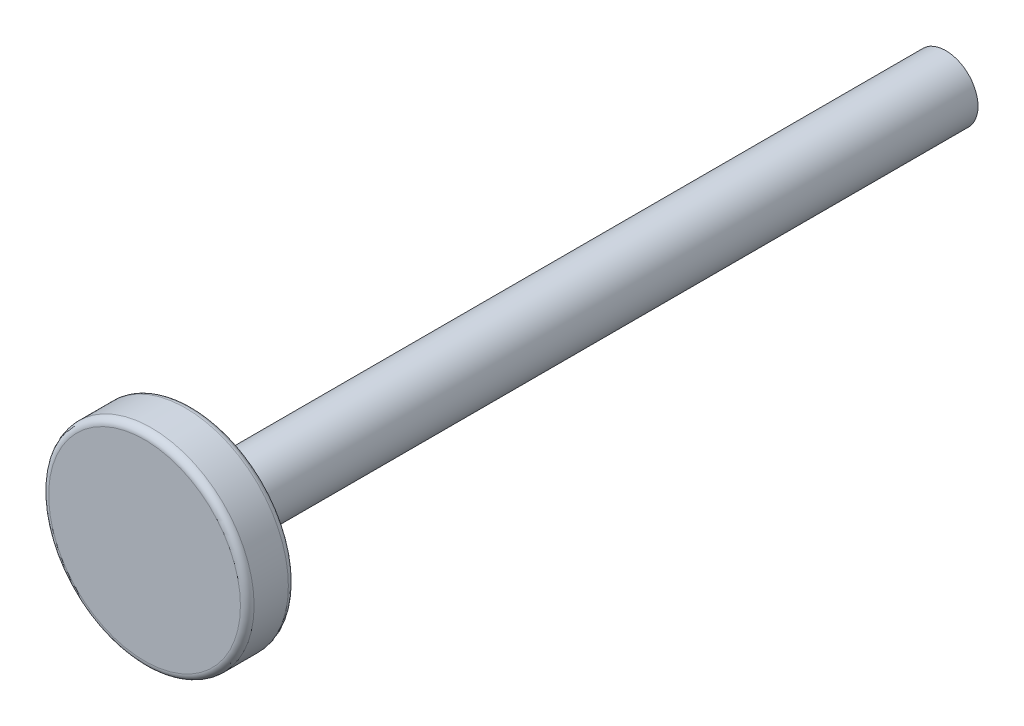
from build123d import *

# Parameters (mm, degrees)
SKETCH2_R                       = 2.35
BOSS_EXTRUDE1_DEPTH             = 55
SKETCH3_R                       = 7.5
BOSS_EXTRUDE2_DEPTH             = 3.5
FILLET1_R                       = 0.5
M3X0_5_TAPPED_HOLE1_D           = 2.5
M3X0_5_TAPPED_HOLE1_DEPTH       = 20
M3X0_5_TAPPED_HOLE1_CSINK_D     = 3.05
M3X0_5_TAPPED_HOLE1_CSINK_ANGLE = 90
M3X0_5_TAPPED_HOLE1_TIP         = 0.751075774


with BuildPart() as part:
    # Sketch2 → Boss-Extrude1 (new body)
    with BuildSketch(Plane.XY.offset(7.432534475)):
        with Locations((-105.393983784, 23.97)):
            Circle(SKETCH2_R)
    extrude(amount=BOSS_EXTRUDE1_DEPTH)

    # Sketch3 → Boss-Extrude2 (add)
    with BuildSketch(Plane.XY.offset(62.432534475)):
        with Locations((-105.393983784, 23.97)):
            Circle(SKETCH3_R)
    extrude(amount=BOSS_EXTRUDE2_DEPTH)

    # Fillet1
    fillet1_edges = [part.edges().sort_by_distance(p)[0] for p in [
        (-112.893983784, 23.97, 65.932534475),
        (-112.893983784, 23.97, 62.432534475),
        (-107.743983784, 23.97, 62.432534475),
    ]]
    fillet(fillet1_edges, radius=FILLET1_R)

    # M3x0.5 Tapped Hole1
    with Locations(Plane(origin=(-105.393983784, 23.97, 7.432534475), x_dir=(-1, 0, 0), z_dir=(0, 0, -1))):
        with Locations((0, 0)):
            CounterSinkHole(M3X0_5_TAPPED_HOLE1_D / 2, M3X0_5_TAPPED_HOLE1_CSINK_D / 2, depth=M3X0_5_TAPPED_HOLE1_DEPTH, counter_sink_angle=M3X0_5_TAPPED_HOLE1_CSINK_ANGLE)
            with Locations((0, 0, -(M3X0_5_TAPPED_HOLE1_DEPTH + M3X0_5_TAPPED_HOLE1_TIP / 2))):  # 118° drill point
                Cone(0, M3X0_5_TAPPED_HOLE1_D / 2, M3X0_5_TAPPED_HOLE1_TIP, mode=Mode.SUBTRACT)


solid = part.part
